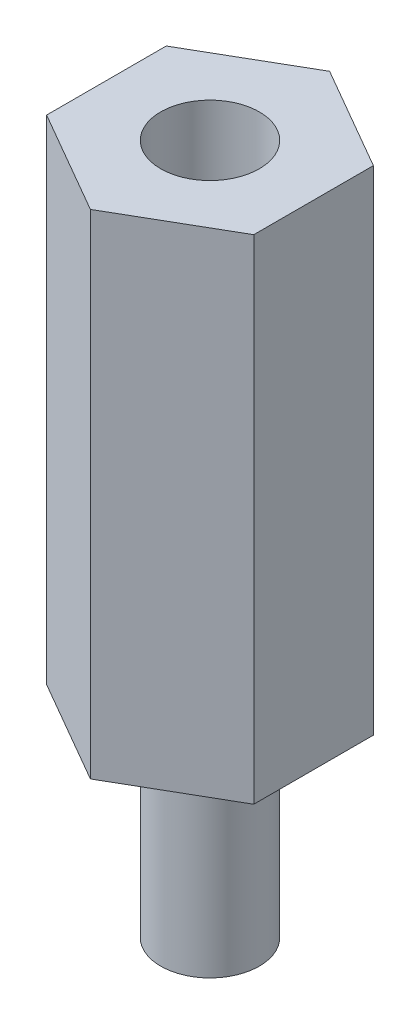
from build123d import *

# Parameters (mm, degrees)
BOSS_EXTRUDE1_DEPTH = 15
SKETCH2_R           = 1.5
BOSS_EXTRUDE2_DEPTH = 6
SKETCH3_R           = 1.5
CUT_EXTRUDE1_DEPTH  = 3


with BuildPart() as part:
    # Sketch1 → Boss-Extrude1 (new body)
    with BuildSketch(Plane(origin=(0, 0, 0), x_dir=(1, 0, 0), z_dir=(0, 1, 0))):
        Polygon((0, 3.637306696), (-3.15, 1.818653348), (-3.15, -1.818653348), (0, -3.637306696), (3.15, -1.818653348), (3.15, 1.818653348), align=None)
    extrude(amount=BOSS_EXTRUDE1_DEPTH)

    # Sketch2 → Boss-Extrude2 (add)
    with BuildSketch(Plane.XZ):
        with Locations(Location((0, 0, 0), (0, 0, 270))):
            Circle(SKETCH2_R)
    extrude(amount=BOSS_EXTRUDE2_DEPTH)

    # Sketch3 → Cut-Extrude1 (cut)
    with BuildSketch(Plane(origin=(0, 15, 0), x_dir=(1, 0, 0), z_dir=(0, 1, 0))):
        with Locations(Location((0, 0, 0), (0, 0, 90))):
            Circle(SKETCH3_R)
    extrude(amount=-CUT_EXTRUDE1_DEPTH, mode=Mode.SUBTRACT)


solid = part.part
